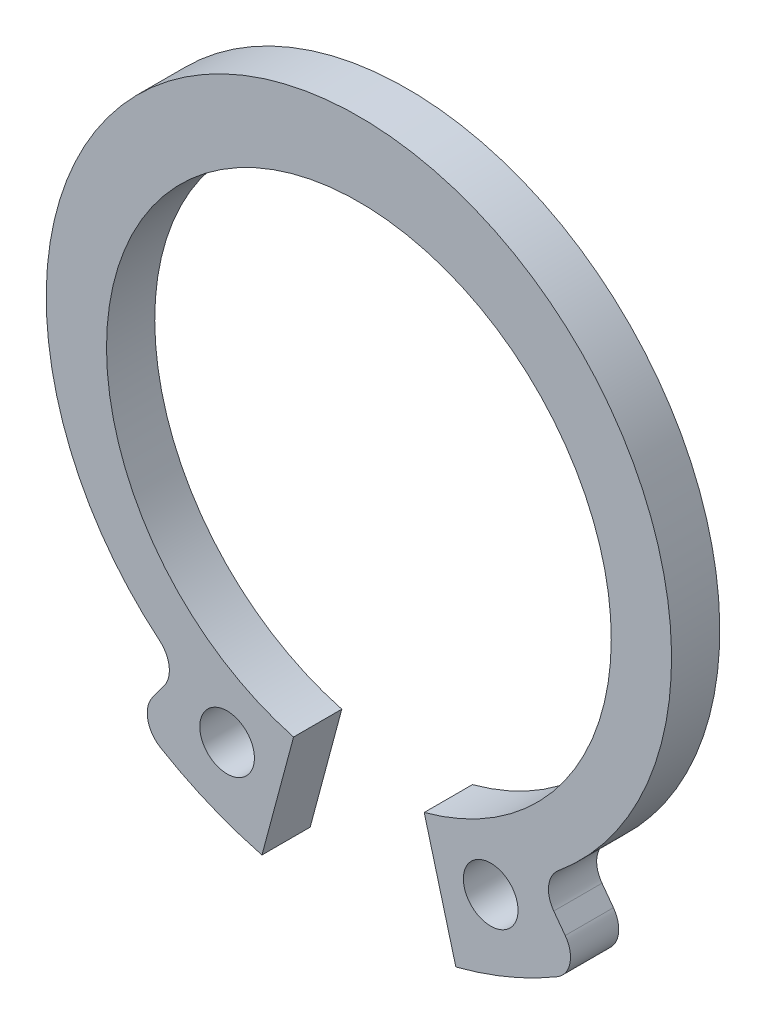
from build123d import *

# Parameters (mm, degrees)
ESQUISSE1_R          = 0.85
BASE_EXTRUSION_DEPTH = 1.5


with BuildPart() as part:
    # Esquisse1 → Base-Extrusion (new body)
    with BuildSketch(Plane.XY):
        with BuildLine():
            Line((6.061647338, -8.22330916), (6.416839232, -8.705167076))
            ThreePointArc((6.416839232, -8.705167076), (6.565790184, -9.377899816), (6.167274285, -9.939985933))
            ThreePointArc((6.167274285, -9.939985933), (4.637960306, -10.708621589), (3.015241875, -11.253035876))
            Line((3.015241875, -11.253035876), (2.031729504, -7.582517736))
            ThreePointArc((2.031729504, -7.582517736), (0, 7.85), (-2.031729504, -7.582517736))
            Line((-2.031729504, -7.582517736), (-3.015241875, -11.253035876))
            ThreePointArc((-3.015241875, -11.253035876), (-4.637960306, -10.708621589), (-6.167274285, -9.939985933))
            ThreePointArc((-6.167274285, -9.939985933), (-6.565790184, -9.377899816), (-6.416839232, -8.705167076))
            Line((-6.416839232, -8.705167076), (-6.061647338, -8.22330916))
            ThreePointArc((-6.061647338, -8.22330916), (-5.902158651, -7.61560057), (-6.20363106, -7.064364905))
            ThreePointArc((-6.20363106, -7.064364905), (0, 10.15), (6.20363106, -7.064364905))
            ThreePointArc((6.20363106, -7.064364905), (5.902158651, -7.61560057), (6.061647338, -8.22330916))
        make_face()
        with Locations((4.099501894, -8.761251835)):
            Circle(ESQUISSE1_R, mode=Mode.SUBTRACT)
        with Locations(Location((-4.099501894, -8.761251835, 0), (0, 0, 180))):
            Circle(ESQUISSE1_R, mode=Mode.SUBTRACT)
    extrude(amount=BASE_EXTRUSION_DEPTH)


solid = part.part
